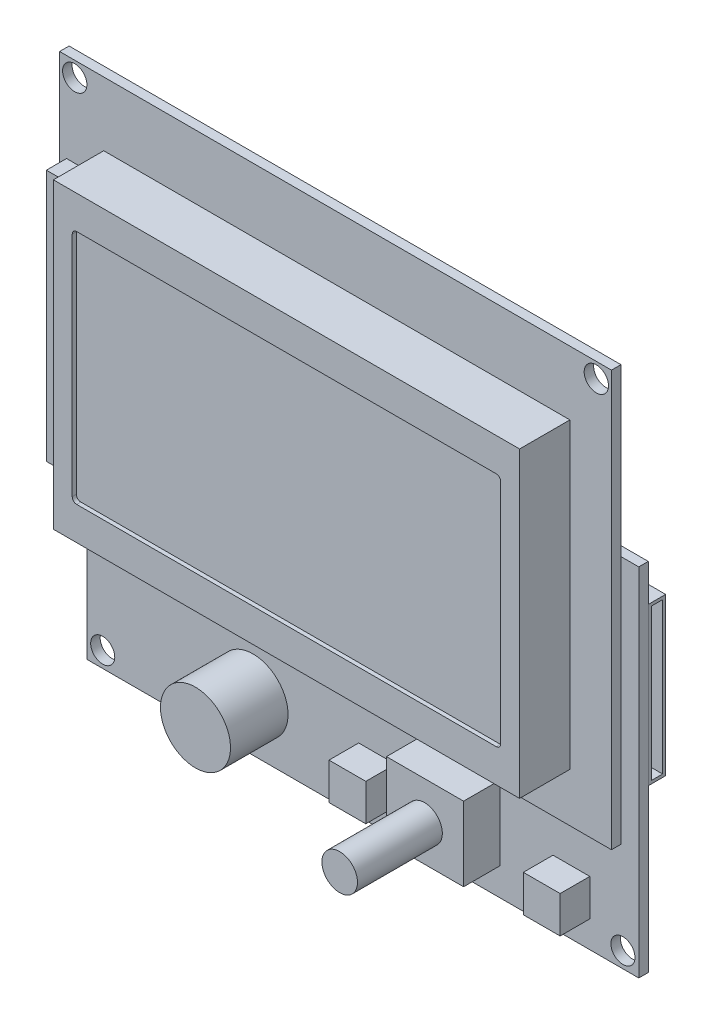
from build123d import *

# Parameters (mm, degrees)
SKETCH6_W            = 93
SKETCH6_H            = 70
SKETCH6_R            = 2.05
GREEN_PCB_DEPTH      = 1.6
SKETCH57_W           = 93
SKETCH57_H           = 60
SKETCH57_R           = 2.032
WHITE_PCB_DEPTH      = 1.6
JUMPER_DEPTH         = 8.509
LCD_PINS_DEPTH       = 3
LCD_BASE_DEPTH       = 3.4
SKETCH109_W          = 78.56
SKETCH109_H          = 51
LCD_SCREEN_DEPTH     = 5.083556
LCD_GLASS_DEPTH      = 0.762
SKETCH17_W           = 25.5
SKETCH17_H           = 26.4668
SD_CARD_DEPTH        = 2.93
SKETCH24_W           = 6.2
SKETCH24_H           = 6.2
STOP_DEPTH           = 5
SKETCH32_W           = 6.2
SKETCH32_H           = 6.2
LIGHT_DEPTH          = 5
SKETCH40_W           = 13
SKETCH40_H           = 12.5
SELECTOR_DEPTH       = 6.1
SKETCH41_R           = 3
SELECTOR_SHAFT_DEPTH = 14.3
SKETCH49_R           = 5.9
SPEAKER_DEPTH        = 9.7
SKETCH77_R           = 3.15
CAPACITOR_DEPTH      = 8
SKETCH78_W           = 20.25
SKETCH78_H           = 8.6
EPX1_DEPTH           = 8.7
SKETCH88_W           = 20.25
SKETCH88_H           = 8.6
EXP2_DEPTH           = 8.7
SHELL2_T             = -0.508
SHELL3_T             = -1.016
SHELL4_T             = -1.016


with BuildPart() as part:
    # Sketch6 → Green PCB (new body)
    with BuildSketch(Plane(origin=(0, 0, 4.6), x_dir=(-1, 0, 0), z_dir=(0, 0, -1))):
        with Locations((46.5, 56.016)):
            Rectangle(SKETCH6_W, SKETCH6_H)
        with Locations((90.45, 88.466)):
            Circle(SKETCH6_R, mode=Mode.SUBTRACT)
        with Locations((2.55, 88.466)):
            Circle(SKETCH6_R, mode=Mode.SUBTRACT)
    extrude(amount=-GREEN_PCB_DEPTH)



with BuildPart() as body_2:
    # Sketch57 → White PCB (new body)
    with BuildSketch(Plane.XY.offset(1.6)):
        with Locations((-46.5, 30)):
            Rectangle(SKETCH57_W, SKETCH57_H)
        with Locations((-2.667, 2.667)):
            Circle(SKETCH57_R, mode=Mode.SUBTRACT)
        with Locations((-90.333, 2.667)):
            Circle(SKETCH57_R, mode=Mode.SUBTRACT)
    extrude(amount=-WHITE_PCB_DEPTH)

    # Sketch122 → Jumper (add)
    with BuildSketch(Plane.XY):
        with BuildLine():
            Line((-84.11, 41.966), (-84.11, 39.934))
            ThreePointArc((-84.11, 39.934), (-84.035605122, 39.754394878), (-83.856, 39.68))
            Line((-83.856, 39.68), (-76.744, 39.68))
            ThreePointArc((-76.744, 39.68), (-76.564394878, 39.754394878), (-76.49, 39.934))
            Line((-76.49, 39.934), (-76.49, 41.966))
            ThreePointArc((-76.49, 41.966), (-76.564394878, 42.145605122), (-76.744, 42.22))
            Line((-76.744, 42.22), (-83.856, 42.22))
            ThreePointArc((-83.856, 42.22), (-84.035605122, 42.145605122), (-84.11, 41.966))
        make_face()
    extrude(amount=-JUMPER_DEPTH)


with BuildPart() as part_1:
    add(part.part)

    add(body_2.part)  # LCD Pins merges body 2
    # Sketch123 → LCD Pins (add)
    with BuildSketch(Plane(origin=(0, 0, 4.6), x_dir=(-1, 0, 0), z_dir=(0, 0, -1))):
        with BuildLine():
            Line((80.3, 21.905), (80.3, 22.921))
            ThreePointArc((80.3, 22.921), (80.225605122, 23.100605122), (80.046, 23.175))
            Line((80.046, 23.175), (29.718, 23.175))
            ThreePointArc((29.718, 23.175), (29.538394878, 23.100605122), (29.464, 22.921))
            Line((29.464, 22.921), (29.464, 21.905))
            ThreePointArc((29.464, 21.905), (29.538394878, 21.725394878), (29.718, 21.651))
            Line((29.718, 21.651), (80.046, 21.651))
            ThreePointArc((80.046, 21.651), (80.225605122, 21.725394878), (80.3, 21.905))
        make_face()
    extrude(amount=LCD_PINS_DEPTH)

    # Sketch98 → LCD Base (add)
    with BuildSketch(Plane.XY.offset(6.2)):
        Polygon((-85.56, 75.98), (-91.83, 75.98), (-91.83, 33.48), (-85.56, 33.48), (-85.56, 29.25), (-7, 29.25), (-7, 80.25), (-85.56, 80.25), align=None)
    extrude(amount=LCD_BASE_DEPTH)

    # Sketch109 → LCD Screen (add)
    with BuildSketch(Plane.XY.offset(9.59993)):
        with Locations((-46.28, 54.75)):
            Rectangle(SKETCH109_W, SKETCH109_H)
    extrude(amount=LCD_SCREEN_DEPTH)

    # Sketch121 → LCD Glass (cut)
    with BuildSketch(Plane.XY.offset(14.752066)):
        with BuildLine():
            Line((-82.385, 73.9), (-82.385, 35.6))
            ThreePointArc((-82.385, 35.6), (-82.161815367, 35.061184633), (-81.623, 34.838))
            Line((-81.623, 34.838), (-10.937, 34.838))
            ThreePointArc((-10.937, 34.838), (-10.398184633, 35.061184633), (-10.175, 35.6))
            Line((-10.175, 35.6), (-10.175, 73.9))
            ThreePointArc((-10.175, 73.9), (-10.398184633, 74.438815367), (-10.937, 74.662))
            Line((-10.937, 74.662), (-81.623, 74.662))
            ThreePointArc((-81.623, 74.662), (-82.161815367, 74.438815367), (-82.385, 73.9))
        make_face()
    extrude(amount=-LCD_GLASS_DEPTH, mode=Mode.SUBTRACT)


with BuildPart() as body_2_2:
    # Sketch17 → SD Card (new body)
    with BuildSketch(Plane(origin=(0, 0, -2.93), x_dir=(-1, 0, 0), z_dir=(0, 0, -1))):
        with Locations((12.75, 40.4876)):
            Rectangle(SKETCH17_W, SKETCH17_H)
    extrude(amount=-SD_CARD_DEPTH)

    # Shell2
    shell2_openings = [body_2_2.faces().sort_by_distance(p)[0] for p in [
        (0, 40.4876, -1.465),
    ]]
    offset(amount=SHELL2_T, openings=shell2_openings, kind=Kind.INTERSECTION)


with BuildPart() as body_3:
    # Sketch24 → Stop (new body)
    with BuildSketch(Plane(origin=(0, 0, 1.6), x_dir=(-1, 0, 0), z_dir=(0, 0, -1))):
        with Locations((44.1, 7.6)):
            Rectangle(SKETCH24_W, SKETCH24_H)
    extrude(amount=-STOP_DEPTH)


with BuildPart() as body_4:
    # Sketch32 → Light (new body)
    with BuildSketch(Plane(origin=(0, 0, 1.6), x_dir=(-1, 0, 0), z_dir=(0, 0, -1))):
        with Locations((11.35, 7.6)):
            Rectangle(SKETCH32_W, SKETCH32_H)
    extrude(amount=-LIGHT_DEPTH)


with BuildPart() as body_5:
    # Sketch40 → Selector (new body)
    with BuildSketch(Plane(origin=(0, 0, 1.6), x_dir=(-1, 0, 0), z_dir=(0, 0, -1))):
        with Locations((29.92, 10.9)):
            Rectangle(SKETCH40_W, SKETCH40_H)
    extrude(amount=-SELECTOR_DEPTH)

    # Sketch41 → Selector Shaft (add)
    with BuildSketch(Plane.XY.offset(7.7)):
        with Locations(Location((-30, 10.65, 0), (0, 0, 180))):
            Circle(SKETCH41_R)
    extrude(amount=SELECTOR_SHAFT_DEPTH)


with BuildPart() as body_6:
    # Sketch49 → Speaker (new body)
    with BuildSketch(Plane(origin=(0, 0, 1.6), x_dir=(-1, 0, 0), z_dir=(0, 0, -1))):
        with Locations((65, 8.9)):
            Circle(SKETCH49_R)
    extrude(amount=-SPEAKER_DEPTH)


with BuildPart() as body_7:
    # Sketch77 → Capacitor (new body)
    with BuildSketch(Plane(origin=(0, 0, 0), x_dir=(-1, 0, 0), z_dir=(0, 0, -1))):
        with Locations((64.1, 30)):
            Circle(SKETCH77_R)
    extrude(amount=CAPACITOR_DEPTH)


with BuildPart() as body_8:
    # Sketch78 → EPX1 (new body)
    with BuildSketch(Plane(origin=(0, 0, 0), x_dir=(-1, 0, 0), z_dir=(0, 0, -1))):
        with Locations((76.275, 54)):
            Rectangle(SKETCH78_W, SKETCH78_H)
    extrude(amount=EPX1_DEPTH)

    # Shell4
    shell4_openings = [body_8.faces().sort_by_distance(p)[0] for p in [
        (-76.275, 54, -8.7),
    ]]
    offset(amount=SHELL4_T, openings=shell4_openings, kind=Kind.INTERSECTION)


with BuildPart() as body_9:
    # Sketch88 → Exp2 (new body)
    with BuildSketch(Plane(origin=(0, 0, 0), x_dir=(-1, 0, 0), z_dir=(0, 0, -1))):
        with Locations((54.975, 54)):
            Rectangle(SKETCH88_W, SKETCH88_H)
    extrude(amount=EXP2_DEPTH)

    # Shell3
    shell3_openings = [body_9.faces().sort_by_distance(p)[0] for p in [
        (-54.975, 54, -8.7),
    ]]
    offset(amount=SHELL3_T, openings=shell3_openings, kind=Kind.INTERSECTION)


solid = Compound([part_1.part, body_2_2.part, body_3.part, body_4.part, body_5.part, body_6.part, body_7.part, body_8.part, body_9.part])
